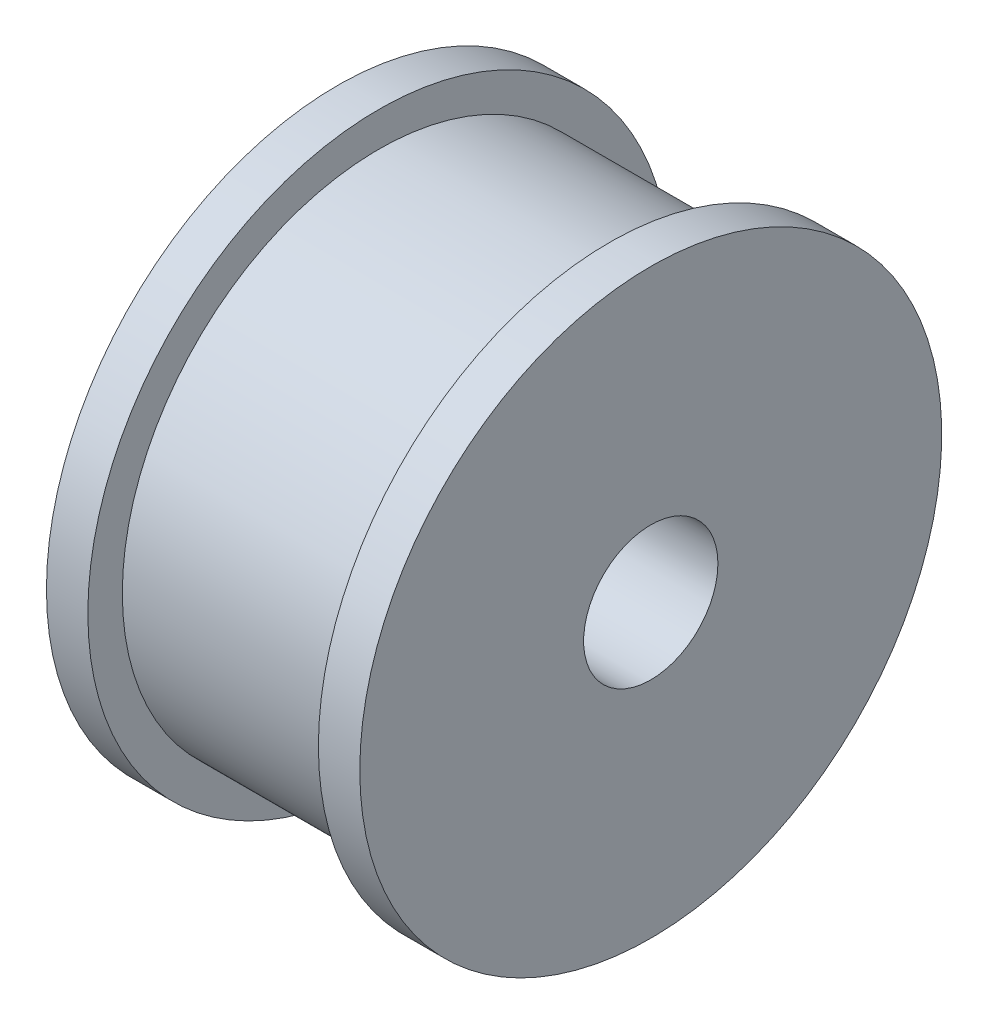
from build123d import *

# Parameters (mm, degrees)
F_6_0_6_DIAMETER_HOLE2_D     = 6
F_6_0_6_DIAMETER_HOLE2_DEPTH = 24
F_6_0_6_DIAMETER_HOLE2_TIP   = 1.802581857


with BuildPart() as part:
    # Sketch1 → Revolve1 (revolve)
    with BuildSketch(Plane(origin=(0, 0, 0), x_dir=(1, 0, 0), z_dir=(0, 1, 0))):
        Polygon((0, -11.46), (-5.15, -11.46), (-5.15, -13), (-7, -13), (-7, 0), (7, 0), (7, -13), (5.15, -13), (5.15, -11.46), align=None)
    revolve(axis=Axis((-7, 0, 0), (1, 0, 0)))

    # Ø6.0 (6) Diameter Hole2
    with Locations(Plane(origin=(7, 0, 0), x_dir=(0, 0, -1), z_dir=(1, 0, 0))):
        with Locations((0, 0)):
            Hole(F_6_0_6_DIAMETER_HOLE2_D / 2, depth=F_6_0_6_DIAMETER_HOLE2_DEPTH)
            with Locations((0, 0, -(F_6_0_6_DIAMETER_HOLE2_DEPTH + F_6_0_6_DIAMETER_HOLE2_TIP / 2))):  # 118° drill point
                Cone(0, F_6_0_6_DIAMETER_HOLE2_D / 2, F_6_0_6_DIAMETER_HOLE2_TIP, mode=Mode.SUBTRACT)


solid = part.part
